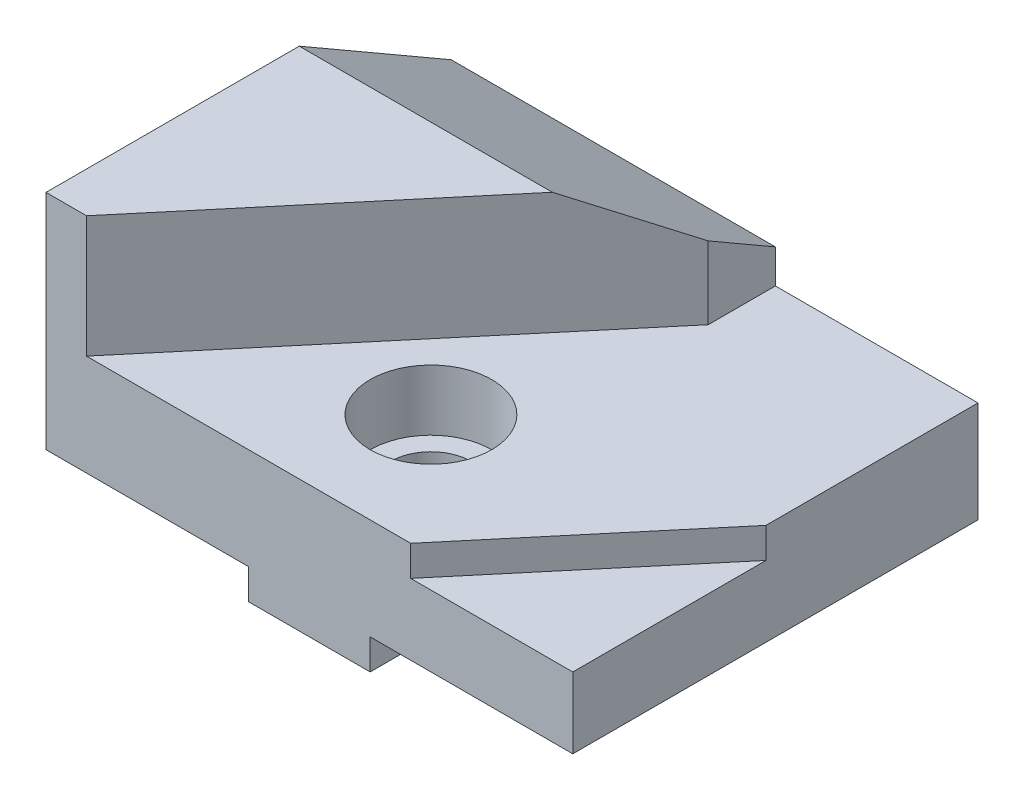
from build123d import *

# Parameters (mm, degrees)
BOSS_EXTRU_2_DEPTH                                 = 63.5
ENL_V_MAT_EXTRU_2_DEPTH                            = 86.50422961
ENL_V_MAT_EXTRU_2_DEPTH_BACK                       = 19.05
CHANFREIN2_SIZE                                    = 23.8125
CHANFREIN2_SIZE2                                   = 13.748153285
ENL_V_MAT_EXTRU_3_DEPTH                            = 4.7625
CHAMBRAGE_POUR_VIS_T_TE_RONDE_BOMB_E_1_D           = 12.7
CHAMBRAGE_POUR_VIS_T_TE_RONDE_BOMB_E_1_CBORE_D     = 19.05
CHAMBRAGE_POUR_VIS_T_TE_RONDE_BOMB_E_1_CBORE_DEPTH = 9.525


with BuildPart() as part:
    # Esquisse4 → Boss.-Extru.2 (new body)
    with BuildSketch(Plane.XY):
        Polygon((-9.525, 0), (9.525, 0), (9.525, 4.7625), (41.275, 4.7625), (41.275, 39.6875), (-41.275, 39.6875), (-41.275, 4.7625), (-9.525, 4.7625), align=None)
    extrude(amount=-BOSS_EXTRU_2_DEPTH)

    # Esquisse5 → Enlèv. mat.-Extru.2 (cut, two sides: drawn at the far end of the back side and taken through both)
    with BuildSketch(Plane(origin=(0, 39.6875, 0), x_dir=(1, 0, 0), z_dir=(0, 1, 0)).offset(-ENL_V_MAT_EXTRU_2_DEPTH_BACK)):
        Polygon((-168.869301791, -159.628602867), (-34.925, 0), (9.525, 52.973447191), (9.525, 63.5), (9.525, 271.880341768), (394.669675583, 112.653942539), (216.275373793, -318.855002095), align=None)
    extrude(amount=ENL_V_MAT_EXTRU_2_DEPTH + ENL_V_MAT_EXTRU_2_DEPTH_BACK, mode=Mode.SUBTRACT)

    # Chanfrein2
    chanfrein2_edges = [part.edges().sort_by_distance(p)[0] for p in [
        (-15.875, 39.6875, -63.5),
    ]]
    chanfrein2_side = [part.faces().sort_by_distance(p)[0] for p in [
        (-21.957665059, 39.6875, -39.849342066),
    ]]
    chamfer(chanfrein2_edges, length=CHANFREIN2_SIZE, length2=CHANFREIN2_SIZE2, reference=chanfrein2_side[0])

    # Esquisse6 → Enlèv. mat.-Extru.3 (cut)
    with BuildSketch(Plane(origin=(0, 20.6375, 0), x_dir=(1, 0, 0), z_dir=(0, 1, 0))):
        Polygon((15.875, 0), (41.275, 30.270541252), (41.275, 0), align=None)
    extrude(amount=-ENL_V_MAT_EXTRU_3_DEPTH, mode=Mode.SUBTRACT)

    # Chambrage pour vis à tête ronde bombée 1/21 (through all)
    with Locations(Plane(origin=(0, 20.6375, 0), x_dir=(1, 0, 0), z_dir=(0, 1, 0))):
        with Locations((0, 19.05)):
            CounterBoreHole(CHAMBRAGE_POUR_VIS_T_TE_RONDE_BOMB_E_1_D / 2, CHAMBRAGE_POUR_VIS_T_TE_RONDE_BOMB_E_1_CBORE_D / 2, CHAMBRAGE_POUR_VIS_T_TE_RONDE_BOMB_E_1_CBORE_DEPTH)


solid = part.part
